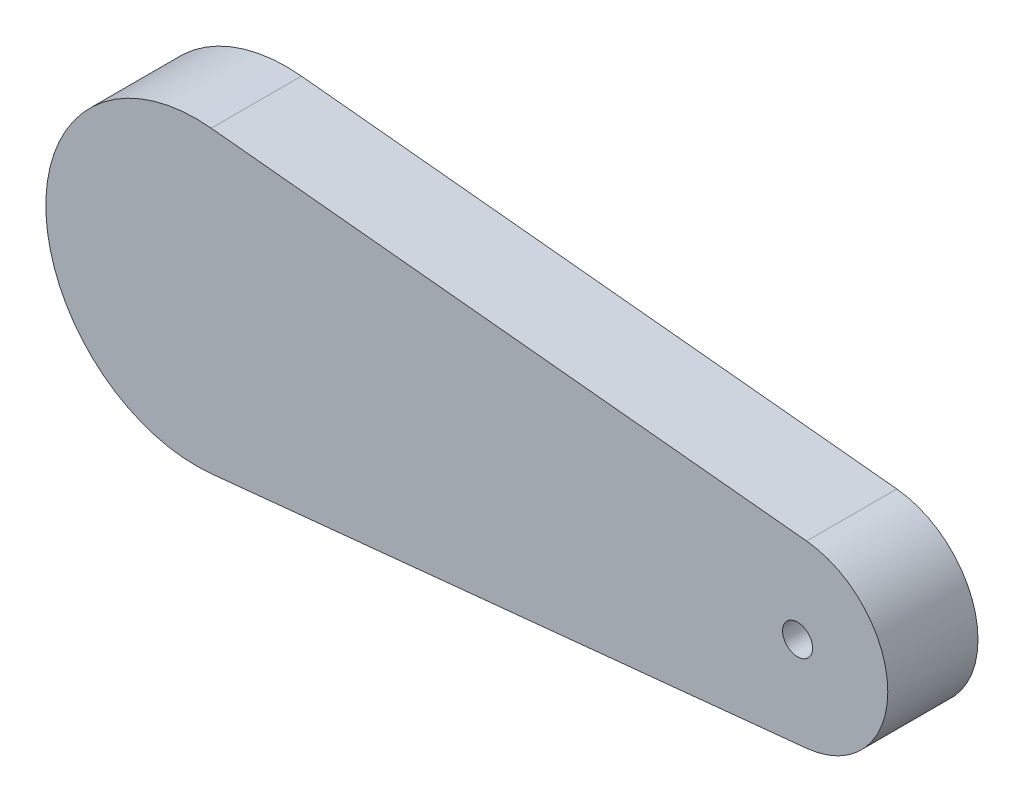
from build123d import *

# Parameters (mm, degrees)
BOSS_EXTRUDE1_DEPTH = 30
SKETCH2_R           = 5
CUT_EXTRUDE1_DEPTH  = 10
SKETCH3_R           = 5
CUT_EXTRUDE2_DEPTH  = 10


with BuildPart() as part:
    # Sketch1 → Boss-Extrude1 (new body)
    with BuildSketch(Plane.XY):
        with BuildLine():
            Line((5, 49.749371855), (203, 29.849623113))
            ThreePointArc((203, 29.849623113), (230, 0), (203, -29.849623113))
            Line((203, -29.849623113), (5, -49.749371855))
            ThreePointArc((5, -49.749371855), (-50, 0), (5, 49.749371855))
        make_face()
    extrude(amount=BOSS_EXTRUDE1_DEPTH)

    # Sketch2 → Cut-Extrude1 (cut)
    with BuildSketch(Plane(origin=(0, 0, 0), x_dir=(-1, 0, 0), z_dir=(0, 0, -1))):
        Circle(SKETCH2_R)
    extrude(amount=-CUT_EXTRUDE1_DEPTH, mode=Mode.SUBTRACT)

    # Sketch3 → Cut-Extrude2 (cut)
    with BuildSketch(Plane.XY.offset(30)):
        with Locations((200, 0)):
            Circle(SKETCH3_R)
    extrude(amount=-CUT_EXTRUDE2_DEPTH, mode=Mode.SUBTRACT)


solid = part.part
